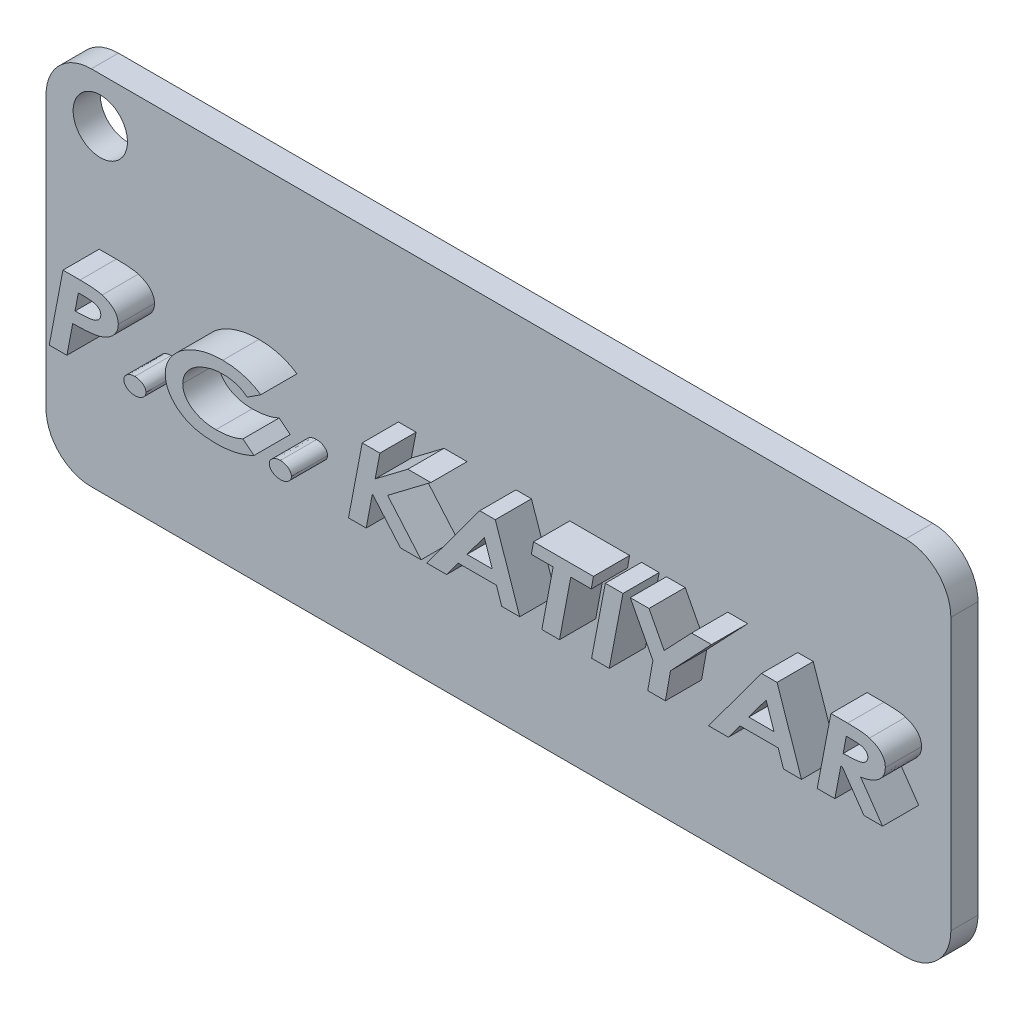
from build123d import *

# Parameters (mm, degrees)
BOSS_EXTRUDE1_DEPTH = 7
CUT_EXTRUDE2_DEPTH  = 2
BOSS_EXTRUDE2_DEPTH = 2
SKETCH14_W          = 50
SKETCH14_H          = 20
CUT_EXTRUDE8_DEPTH  = 2
SKETCH15_W          = 50
SKETCH15_H          = 20
CUT_EXTRUDE9_DEPTH  = 3.5
SKETCH16_R          = 1.5
CUT_EXTRUDE10_DEPTH = 3.5


with BuildPart() as part:
    # Sketch2 → Boss-Extrude1 (new body)
    with BuildSketch(Plane.XY):
        with BuildLine():
            Line((-22.5, -10), (22.5, -10))
            ThreePointArc((22.5, -10), (24.267766953, -9.267766953), (25, -7.5))
            Line((25, -7.5), (25, 7.5))
            ThreePointArc((25, 7.5), (24.267766953, 9.267766953), (22.5, 10))
            Line((22.5, 10), (-22.5, 10))
            ThreePointArc((-22.5, 10), (-24.267766953, 9.267766953), (-25, 7.5))
            Line((-25, 7.5), (-25, -7.5))
            ThreePointArc((-25, -7.5), (-24.267766953, -9.267766953), (-22.5, -10))
        make_face()
    extrude(amount=-BOSS_EXTRUDE1_DEPTH)

    # Sketch3 → Cut-Extrude2 (cut)
    with BuildSketch(Plane(origin=(0, 0, -7), x_dir=(-1, 0, 0), z_dir=(0, 0, -1))):
        with BuildLine():
            Line((-20.5, -8), (20.5, -8))
            ThreePointArc((20.5, -8), (22.267766953, -7.267766953), (23, -5.5))
            Line((23, -5.5), (23, 5.5))
            ThreePointArc((23, 5.5), (22.267766953, 7.267766953), (20.5, 8))
            Line((20.5, 8), (-20.5, 8))
            ThreePointArc((-20.5, 8), (-22.267766953, 7.267766953), (-23, 5.5))
            Line((-23, 5.5), (-23, -5.5))
            ThreePointArc((-23, -5.5), (-22.267766953, -7.267766953), (-20.5, -8))
        make_face()
    extrude(amount=-CUT_EXTRUDE2_DEPTH, mode=Mode.SUBTRACT)

    # Sketch5 → Boss-Extrude2 (add)
    # profile 1 of 11: a face of its own
    with BuildSketch(Plane.XY):
        with BuildLine():
            Line((-22.062655487, 1.585119323), (-21.115784243, 1.585119323))
            add(Edge.make_bspline(
                [(-21.115784243, 1.585119323), (-21.046347286, 1.584923025), (-20.913013856, 1.584546091), (-20.720854318, 1.578680325), (-20.544824071, 1.570314274), (-20.38445275, 1.558333743), (-20.240057002, 1.544038226), (-20.111537314, 1.524529867), (-19.998564044, 1.503771053), (-19.929755147, 1.483856589), (-19.897810485, 1.47461126)],
                knots=[0, 0, 0, 0, 1.358553691, 2.608706277, 3.761225862, 4.806342819, 5.755171958, 6.599208433, 7.349679831, 8, 8, 8, 8], degree=3))
            add(Edge.make_bspline(
                [(-19.897810485, 1.47461126), (-19.862142173, 1.463127485), (-19.792502501, 1.440706284), (-19.692986342, 1.400409035), (-19.599730839, 1.357669122), (-19.51289697, 1.311520104), (-19.432481143, 1.262460691), (-19.358744416, 1.209736648), (-19.291936002, 1.153440385), (-19.232010667, 1.093438482), (-19.178679589, 1.03079519), (-19.132301463, 0.965389138), (-19.09311573, 0.897540141), (-19.060987765, 0.827054161), (-19.03614147, 0.753527366), (-19.019260756, 0.677245067), (-19.00707271, 0.598619745), (-19.00622574, 0.545279075), (-19.005795761, 0.518199752)],
                knots=[0, 0, 0, 0, 1.276660213, 2.492582227, 3.656403132, 4.771545786, 5.841900154, 6.864511781, 7.857869233, 8.815819527, 9.751368605, 10.658498021, 11.544612112, 12.417650074, 13.294463908, 14.183977485, 15.078064426, 16, 16, 16, 16], degree=3))
            add(Edge.make_bspline(
                [(-19.005795761, 0.518199752), (-19.006510333, 0.488477554), (-19.007933397, 0.429286078), (-19.020875513, 0.341828806), (-19.042886627, 0.256846348), (-19.071982447, 0.173362418), (-19.111678127, 0.092832676), (-19.157520739, 0.013069541), (-19.213833084, -0.062914016), (-19.277366682, -0.136754965), (-19.347624943, -0.207107626), (-19.424478433, -0.272735555), (-19.50723746, -0.332739754), (-19.595123082, -0.388972412), (-19.689269565, -0.439769352), (-19.789110837, -0.485723286), (-19.894880016, -0.526317435), (-20.007996891, -0.562964252), (-20.134211975, -0.594162615), (-20.276983298, -0.621593658), (-20.438822371, -0.645146923), (-20.619424629, -0.664714114), (-20.818804268, -0.680404776), (-21.037255177, -0.691874785), (-21.274458726, -0.700899436), (-21.439084643, -0.703299804), (-21.524425569, -0.704544138)],
                knots=[0, 0, 0, 0, 0.688242521, 1.370628487, 2.042130763, 2.719778362, 3.414452177, 4.118823342, 4.848191774, 5.60127844, 6.373952161, 7.14901211, 7.939764489, 8.740180187, 9.564258587, 10.41577627, 11.284491428, 12.187244958, 13.168433779, 14.294132788, 15.553866063, 16.955823887, 18.50157366, 20.186153151, 22.022928429, 24, 24, 24, 24], degree=3))
            Line((-21.524425569, -0.704544138), (-21.845614471, -2.383630677))
            Line((-21.845614471, -2.383630677), (-22.82190153, -2.383630677))
            Line((-22.82190153, -2.383630677), (-22.062655487, 1.585119323))
        make_face()
        with BuildLine():
            add(Edge.make_bspline(
                [(-21.397222043, -0.043085805), (-21.326727305, -0.042246975), (-21.192070476, -0.040644669), (-20.999570874, -0.03489139), (-20.826187735, -0.023736079), (-20.672051894, -0.009138756), (-20.53725684, 0.009739171), (-20.421429542, 0.031877147), (-20.324944781, 0.059524974), (-20.245021746, 0.09039094), (-20.180356017, 0.127620223), (-20.124254392, 0.166231611), (-20.077888535, 0.210638747), (-20.039015151, 0.258397998), (-20.009391185, 0.310954803), (-19.987468978, 0.367318978), (-19.974597194, 0.428047077), (-19.973234602, 0.469908197), (-19.972542556, 0.491169003)],
                knots=[0, 0, 0, 0, 2.015913331, 3.850734162, 5.506089905, 6.983209899, 8.27670128, 9.39723723, 10.351734844, 11.143964697, 11.839511049, 12.480806679, 13.086506669, 13.668763104, 14.23552723, 14.804061629, 15.392595943, 16, 16, 16, 16], degree=3))
            add(Edge.make_bspline(
                [(-19.972542556, 0.491169003), (-19.973681404, 0.514886484), (-19.975925001, 0.561611322), (-19.996199624, 0.628643317), (-20.031130456, 0.688873984), (-20.077580592, 0.743542921), (-20.137934262, 0.790963965), (-20.210935481, 0.830320969), (-20.296542372, 0.862201442), (-20.377670416, 0.881323963), (-20.453559106, 0.893861983), (-20.524474113, 0.901195238), (-20.607931102, 0.908599402), (-20.704201452, 0.913641751), (-20.813106011, 0.918656069), (-20.934769153, 0.921658436), (-21.069139557, 0.923034578), (-21.162955237, 0.923445991), (-21.211981909, 0.92366099)],
                knots=[0, 0, 0, 0, 0.784190741, 1.544902002, 2.291614694, 3.075952733, 3.906502264, 4.817702394, 5.811960417, 6.923020294, 7.572247894, 8.358204391, 9.283036894, 10.346678085, 11.550108322, 12.893256878, 14.376462505, 16, 16, 16, 16], degree=3))
            Line((-21.211981909, 0.92366099), (-21.397222043, -0.043085805))
        make_face(mode=Mode.SUBTRACT)
    # profile 2 of 11: a face of its own
    with BuildSketch(Plane.XY):
        with BuildLine():
            add(Edge.make_bspline(
                [(-18.089930376, -1.518646702), (-18.049495524, -1.519929968), (-17.970681154, -1.522431269), (-17.857520098, -1.54898048), (-17.752678075, -1.590442412), (-17.674214536, -1.639675786), (-17.617955838, -1.685119371), (-17.580811101, -1.720991227), (-17.549794608, -1.759290621), (-17.524033872, -1.799222904), (-17.504043319, -1.840886466), (-17.489213264, -1.884290377), (-17.481585498, -1.929938038), (-17.480102811, -1.96092063), (-17.479353453, -1.976579395)],
                knots=[0, 0, 0, 0, 1.721928974, 3.356330997, 4.928568575, 6.512627655, 7.284123422, 8.011545403, 8.71066186, 9.38170703, 10.03392191, 10.677359324, 11.331530462, 12, 12, 12, 12], degree=3))
            add(Edge.make_bspline(
                [(-17.479353453, -1.976579395), (-17.480096192, -1.991975439), (-17.481565676, -2.022435994), (-17.489332125, -2.067520667), (-17.504034515, -2.110683155), (-17.524034431, -2.152347957), (-17.549801839, -2.192268285), (-17.58077969, -2.230617025), (-17.618203807, -2.266407811), (-17.673752259, -2.313010623), (-17.752989631, -2.361503193), (-17.857173734, -2.404736837), (-17.970867411, -2.4293882), (-18.049533204, -2.432773591), (-18.089930376, -2.434512087)],
                knots=[0, 0, 0, 0, 0.657885995, 1.301605321, 1.945722372, 2.598626161, 3.27038013, 3.970235035, 4.698425363, 5.477915097, 7.063647356, 8.641811216, 10.275472388, 12, 12, 12, 12], degree=3))
            add(Edge.make_bspline(
                [(-18.089930376, -2.434512087), (-18.130864166, -2.432797355), (-18.21033288, -2.429468381), (-18.324986133, -2.404650825), (-18.429838816, -2.362000598), (-18.522713501, -2.303666895), (-18.600950066, -2.234231435), (-18.658270232, -2.154881959), (-18.694294772, -2.06797376), (-18.698431403, -2.007118534), (-18.700507299, -1.976579395)],
                knots=[0, 0, 0, 0, 1.164019638, 2.259823604, 3.318264968, 4.36837637, 5.366452163, 6.2744366, 7.134055954, 8, 8, 8, 8], degree=3))
            add(Edge.make_bspline(
                [(-18.700507299, -1.976579395), (-18.69975227, -1.960923396), (-18.698258362, -1.929946276), (-18.690712929, -1.884258466), (-18.675612372, -1.841111577), (-18.656854306, -1.798974208), (-18.630710394, -1.759602571), (-18.600753545, -1.720686323), (-18.56349347, -1.685414571), (-18.50829092, -1.63942498), (-18.429968159, -1.590117168), (-18.324691182, -1.549021189), (-18.210504965, -1.52236192), (-18.130897346, -1.519909002), (-18.089930376, -1.518646702)],
                knots=[0, 0, 0, 0, 0.667698794, 1.321115674, 1.963811206, 2.610461825, 3.280733282, 3.971979179, 4.698562444, 5.460433722, 7.033089376, 8.613992008, 10.25752247, 12, 12, 12, 12], degree=3))
        make_face()
    # profile 3 of 11: a face of its own
    with BuildSketch(Plane.XY):
        with BuildLine():
            Line((-11.132692546, 1.085845485), (-11.881603303, 0.593726845))
            add(Edge.make_bspline(
                [(-11.881603303, 0.593726845), (-11.923562265, 0.627314114), (-12.008638639, 0.695415968), (-12.151765717, 0.780674808), (-12.307463858, 0.854901668), (-12.475847445, 0.916255533), (-12.654190151, 0.965495989), (-12.841148347, 1.000313767), (-13.035495412, 1.021252539), (-13.167631772, 1.024018998), (-13.234730807, 1.02542381)],
                knots=[0, 0, 0, 0, 0.889229551, 1.803009952, 2.751198743, 3.742627655, 4.766939058, 5.811943641, 6.888901805, 8, 8, 8, 8], degree=3))
            add(Edge.make_bspline(
                [(-13.234730807, 1.02542381), (-13.282184801, 1.024862225), (-13.376941556, 1.023740843), (-13.51812958, 1.01316255), (-13.657890686, 0.995454725), (-13.796090126, 0.971562928), (-13.933261695, 0.941809562), (-14.068325215, 0.903103243), (-14.202036525, 0.858602603), (-14.333559695, 0.80812665), (-14.460328424, 0.751411346), (-14.580864544, 0.689770032), (-14.69473935, 0.625147461), (-14.800882854, 0.554881541), (-14.899411749, 0.479978456), (-14.991460245, 0.401568616), (-15.074814192, 0.317308467), (-15.152137059, 0.230638368), (-15.22021116, 0.13990146), (-15.280087387, 0.047914827), (-15.330693605, -0.045914637), (-15.372101932, -0.141075571), (-15.404188062, -0.238235203), (-15.427283192, -0.336631816), (-15.44117275, -0.436756529), (-15.44311974, -0.503890968), (-15.444097043, -0.537589511)],
                knots=[0, 0, 0, 0, 1.147840019, 2.292021974, 3.422762477, 4.554719973, 5.683987435, 6.816453138, 7.951746113, 9.092312325, 10.222980131, 11.309625257, 12.366415312, 13.388810317, 14.386361657, 15.359174227, 16.311146327, 17.251367513, 18.166849566, 19.052414659, 19.904318703, 20.742752482, 21.559760478, 22.376164587, 23.184905847, 24, 24, 24, 24], degree=3))
            add(Edge.make_bspline(
                [(-15.444097043, -0.537589511), (-15.442603717, -0.582745314), (-15.439657018, -0.671848801), (-15.415159431, -0.802654497), (-15.374445467, -0.92743692), (-15.317252331, -1.046242096), (-15.244137437, -1.159025047), (-15.155290415, -1.266015891), (-15.049924195, -1.366676674), (-14.929655641, -1.46041849), (-14.796735847, -1.545585606), (-14.654044304, -1.620690858), (-14.50174056, -1.683677816), (-14.340568182, -1.735112577), (-14.17010218, -1.774841065), (-13.99101806, -1.803018314), (-13.802750069, -1.821160245), (-13.674156086, -1.822996219), (-13.608391164, -1.823935164)],
                knots=[0, 0, 0, 0, 0.869533254, 1.715802623, 2.553836954, 3.391995718, 4.248873622, 5.13734536, 6.065429815, 7.051113934, 8.070898248, 9.103247636, 10.153921072, 11.242293882, 12.359451302, 13.522930763, 14.733189048, 16, 16, 16, 16], degree=3))
            add(Edge.make_bspline(
                [(-13.608391164, -1.823935164), (-13.537874759, -1.823041656), (-13.398813925, -1.821279626), (-13.193967102, -1.806683414), (-12.99625329, -1.783036157), (-12.805934515, -1.749700301), (-12.622715292, -1.70688744), (-12.446734812, -1.654265982), (-12.277511195, -1.59285337), (-12.169618838, -1.543240585), (-12.116134803, -1.518646702)],
                knots=[0, 0, 0, 0, 1.101721473, 2.17263358, 3.207027447, 4.211833084, 5.190103856, 6.145147665, 7.080518871, 8, 8, 8, 8], degree=3))
            Line((-12.116134803, -1.518646702), (-11.507942947, -2.00997032))
            add(Edge.make_bspline(
                [(-11.507942947, -2.00997032), (-11.585643588, -2.048117935), (-11.741953384, -2.124859204), (-11.986691837, -2.221542025), (-12.240639696, -2.302149423), (-12.50338268, -2.369322998), (-12.774972087, -2.421597605), (-13.05581041, -2.458767878), (-13.345650964, -2.48160382), (-13.542097027, -2.484117798), (-13.641782089, -2.485393497)],
                knots=[0, 0, 0, 0, 0.941032961, 1.893068937, 2.858239335, 3.836792255, 4.840579133, 5.864002295, 6.916104196, 8, 8, 8, 8], degree=3))
            add(Edge.make_bspline(
                [(-13.641782089, -2.485393497), (-13.711495099, -2.484607427), (-13.848360896, -2.483064154), (-14.049640733, -2.471613631), (-14.243078923, -2.4538493), (-14.428463908, -2.42743739), (-14.605732473, -2.394297548), (-14.775151289, -2.353840473), (-14.936460584, -2.305313237), (-15.090239665, -2.249794382), (-15.236195439, -2.18674311), (-15.37475694, -2.117048746), (-15.50533496, -2.039473514), (-15.629128301, -1.956028914), (-15.745465561, -1.865159349), (-15.854645022, -1.767153719), (-15.956463404, -1.662277524), (-16.04991557, -1.551005457), (-16.135202308, -1.435885448), (-16.208071857, -1.316299422), (-16.270685561, -1.195044811), (-16.321977421, -1.071178427), (-16.36157444, -0.944744182), (-16.39067839, -0.815873637), (-16.407577829, -0.684593125), (-16.409753394, -0.596203044), (-16.410843838, -0.551899908)],
                knots=[0, 0, 0, 0, 1.335518246, 2.621989339, 3.86123831, 5.056008121, 6.208106868, 7.315158899, 8.391336172, 9.433675789, 10.445662686, 11.435631841, 12.40301568, 13.353532088, 14.293988395, 15.22875383, 16.162277527, 17.091871979, 18.010882944, 18.904279217, 19.771675937, 20.623070725, 21.469302921, 22.306901117, 23.151379999, 24, 24, 24, 24], degree=3))
            add(Edge.make_bspline(
                [(-16.410843838, -0.551899908), (-16.409778879, -0.504114587), (-16.407650667, -0.408620548), (-16.385419817, -0.266395292), (-16.352736297, -0.125403416), (-16.304696827, 0.013601469), (-16.245644649, 0.151710267), (-16.17035142, 0.286982347), (-16.083851498, 0.421828681), (-15.983565886, 0.553620313), (-15.87332213, 0.682348963), (-15.750753587, 0.802869297), (-15.620117753, 0.917819897), (-15.480254165, 1.026133422), (-15.330173894, 1.126343539), (-15.170633519, 1.21929374), (-15.001999086, 1.306139252), (-14.824283436, 1.38508489), (-14.64032478, 1.456499012), (-14.450882393, 1.517612576), (-14.257577322, 1.570305818), (-14.059915904, 1.613291689), (-13.858110412, 1.645488979), (-13.652584027, 1.669545234), (-13.442710117, 1.684168847), (-13.301270631, 1.685972693), (-13.229960675, 1.686882144)],
                knots=[0, 0, 0, 0, 0.802901381, 1.604515664, 2.41515796, 3.2338925, 4.074136508, 4.937632603, 5.833775986, 6.766009382, 7.720128157, 8.68118343, 9.653730431, 10.644883943, 11.653395727, 12.685928506, 13.748188712, 14.841321317, 15.954372672, 17.064825198, 18.18690293, 19.322280764, 20.464398356, 21.621835016, 22.800993672, 24, 24, 24, 24], degree=3))
            add(Edge.make_bspline(
                [(-13.229960675, 1.686882144), (-13.130517764, 1.685037945), (-12.934680997, 1.681406095), (-12.646152122, 1.653045864), (-12.367888771, 1.60652707), (-12.100089605, 1.540277527), (-11.842106715, 1.455984187), (-11.594529515, 1.352511007), (-11.356877226, 1.23011651), (-11.207490537, 1.133980723), (-11.132692546, 1.085845485)],
                knots=[0, 0, 0, 0, 1.077363834, 2.121694222, 3.138067454, 4.131892869, 5.108055193, 6.07597234, 7.036638365, 8, 8, 8, 8], degree=3))
        make_face()
    # profile 4 of 11: a face of its own
    with BuildSketch(Plane.XY):
        with BuildLine():
            add(Edge.make_bspline(
                [(-10.050667556, -1.518646702), (-10.010232704, -1.519929968), (-9.931418333, -1.522431269), (-9.818257278, -1.54898048), (-9.713415255, -1.590442412), (-9.634951716, -1.639675786), (-9.578693017, -1.685119371), (-9.54154828, -1.720991227), (-9.510531788, -1.759290621), (-9.484771051, -1.799222904), (-9.464780498, -1.840886466), (-9.449950443, -1.884290377), (-9.442322677, -1.929938038), (-9.440839991, -1.96092063), (-9.440090633, -1.976579395)],
                knots=[0, 0, 0, 0, 1.721928974, 3.356330997, 4.928568575, 6.512627655, 7.284123422, 8.011545403, 8.71066186, 9.38170703, 10.03392191, 10.677359324, 11.331530462, 12, 12, 12, 12], degree=3))
            add(Edge.make_bspline(
                [(-9.440090633, -1.976579395), (-9.440833372, -1.991975439), (-9.442302855, -2.022435994), (-9.450069305, -2.067520667), (-9.464771694, -2.110683155), (-9.484771611, -2.152347957), (-9.510539019, -2.192268285), (-9.541516869, -2.230617025), (-9.578940986, -2.266407811), (-9.634489439, -2.313010623), (-9.71372681, -2.361503193), (-9.817910913, -2.404736837), (-9.931604591, -2.4293882), (-10.010270383, -2.432773591), (-10.050667556, -2.434512087)],
                knots=[0, 0, 0, 0, 0.657885995, 1.301605321, 1.945722372, 2.598626161, 3.27038013, 3.970235035, 4.698425363, 5.477915097, 7.063647356, 8.641811216, 10.275472388, 12, 12, 12, 12], degree=3))
            add(Edge.make_bspline(
                [(-10.050667556, -2.434512087), (-10.091601345, -2.432797355), (-10.17107006, -2.429468381), (-10.285723313, -2.404650825), (-10.390575996, -2.362000598), (-10.483450681, -2.303666895), (-10.561687246, -2.234231435), (-10.619007412, -2.154881959), (-10.655031952, -2.06797376), (-10.659168583, -2.007118534), (-10.661244479, -1.976579395)],
                knots=[0, 0, 0, 0, 1.164019638, 2.259823604, 3.318264968, 4.36837637, 5.366452163, 6.2744366, 7.134055954, 8, 8, 8, 8], degree=3))
            add(Edge.make_bspline(
                [(-10.661244479, -1.976579395), (-10.66048945, -1.960923396), (-10.658995541, -1.929946276), (-10.651450108, -1.884258466), (-10.636349552, -1.841111577), (-10.617591485, -1.798974208), (-10.591447574, -1.759602571), (-10.561490725, -1.720686323), (-10.524230649, -1.685414571), (-10.469028099, -1.63942498), (-10.390705339, -1.590117168), (-10.285428362, -1.549021189), (-10.171242145, -1.52236192), (-10.091634526, -1.519909002), (-10.050667556, -1.518646702)],
                knots=[0, 0, 0, 0, 0.667698794, 1.321115674, 1.963811206, 2.610461825, 3.280733282, 3.971979179, 4.698562444, 5.460433722, 7.033089376, 8.613992008, 10.25752247, 12, 12, 12, 12], degree=3))
        make_face()
    # profile 5 of 11: a face of its own
    with BuildSketch(Plane.XY):
        Polygon((-5.526197153, 1.585119323), (-4.549910094, 1.585119323), (-4.810677322, 0.218476445), (-3.005182279, 1.585119323), (-1.731556979, 1.585119323), (-4.123778283, -0.224350829), (-2.272966985, -2.383630677), (-3.414618628, -2.383630677), (-4.963321552, -0.575750569), (-5.309156138, -2.383630677), (-6.285443197, -2.383630677), align=None)
    # profile 6 of 11: a face of its own
    with BuildSketch(Plane.XY):
        Polygon((0.969132875, 1.585119323), (1.826166629, 1.585119323), (3.178499111, -2.383630677), (2.181541479, -2.383630677), (1.887383326, -1.518646702), (-0.224990222, -1.518646702), (-0.863392916, -2.383630677), (-1.960523325, -2.383630677), align=None)
        Polygon((1.661597068, -0.857188369), (1.220359838, 0.43949257), (0.263153307, -0.857188369), align=None, mode=Mode.SUBTRACT)
    # profile 7 of 11: a face of its own
    with BuildSketch(Plane.XY):
        Polygon((3.941720265, 1.585119323), (7.249011931, 1.585119323), (7.13134867, 0.92366099), (5.99844227, 0.92366099), (5.375144994, -2.383630677), (4.399652957, -2.383630677), (5.022950233, 0.92366099), (3.816901805, 0.92366099), align=None)
    # profile 8 of 11: a face of its own
    with BuildSketch(Plane.XY):
        Polygon((7.906495154, 1.585119323), (8.882782214, 1.585119323), (8.12353617, -2.383630677), (7.147249111, -2.383630677), align=None)
    # profile 9 of 11: a face of its own
    with BuildSketch(Plane.XY):
        Polygon((9.284268342, 1.585119323), (10.319387031, 1.585119323), (11.158135279, -0.012079946), (12.6742423, 1.585119323), (13.774552797, 1.585119323), (11.508739996, -0.801536827), (11.225712152, -2.383630677), (10.251015136, -2.383630677), (10.534838003, -0.797561716), align=None)
    # profile 10 of 11: a face of its own
    with BuildSketch(Plane.XY):
        Polygon((16.538844413, 1.585119323), (17.395878167, 1.585119323), (18.748210649, -2.383630677), (17.751253017, -2.383630677), (17.457094864, -1.518646702), (15.344721316, -1.518646702), (14.706318622, -2.383630677), (13.609188213, -2.383630677), align=None)
        Polygon((17.231308606, -0.857188369), (16.790071376, 0.43949257), (15.832864846, -0.857188369), align=None, mode=Mode.SUBTRACT)
    # profile 11 of 11: a face of its own
    with BuildSketch(Plane.XY):
        with BuildLine():
            Line((20.372440667, 1.585119323), (21.296256272, 1.585119323))
            add(Edge.make_bspline(
                [(21.296256272, 1.585119323), (21.364897656, 1.584912264), (21.497170108, 1.584513258), (21.687482531, 1.5787606), (21.861903515, 1.570177483), (22.020504785, 1.558694865), (22.163168872, 1.54290706), (22.290297173, 1.524109823), (22.401477252, 1.501994215), (22.469288073, 1.482196409), (22.500714656, 1.473021216)],
                knots=[0, 0, 0, 0, 1.357552076, 2.616012828, 3.765317172, 4.811306205, 5.760556428, 6.603372588, 7.352740091, 8, 8, 8, 8], degree=3))
            add(Edge.make_bspline(
                [(22.500714656, 1.473021216), (22.536088956, 1.46119059), (22.60507071, 1.438120244), (22.704173212, 1.398234342), (22.796402983, 1.354404852), (22.882367206, 1.307781822), (22.96131326, 1.257650455), (23.033537671, 1.204201062), (23.09867077, 1.146764428), (23.157928225, 1.086571186), (23.209374738, 1.022480307), (23.255608963, 0.956758844), (23.2925185, 0.886507447), (23.325007119, 0.814715213), (23.348541815, 0.739014718), (23.366179286, 0.661176861), (23.376834207, 0.580241953), (23.377885233, 0.525386693), (23.378418983, 0.497529179)],
                knots=[0, 0, 0, 0, 1.265921014, 2.468612838, 3.62342398, 4.730439793, 5.786007646, 6.795294932, 7.776904084, 8.731092297, 9.658314142, 10.564037002, 11.453533417, 12.347702471, 13.235286478, 14.138773092, 15.054800702, 16, 16, 16, 16], degree=3))
            add(Edge.make_bspline(
                [(23.378418983, 0.497529179), (23.377311606, 0.463282067), (23.37511914, 0.395477054), (23.358789285, 0.295749378), (23.332379099, 0.199556011), (23.295819506, 0.106788722), (23.247709076, 0.017953725), (23.188294069, -0.066219058), (23.119336224, -0.147362024), (23.039671869, -0.224186334), (22.949755587, -0.29712389), (22.847763038, -0.362525214), (22.736393284, -0.424356388), (22.613400043, -0.478604004), (22.480132268, -0.527991582), (22.336016921, -0.571695528), (22.180798341, -0.608654028), (22.073348184, -0.628932497), (22.01813628, -0.639352331)],
                knots=[0, 0, 0, 0, 0.84795453, 1.678844306, 2.495720211, 3.314781864, 4.142971073, 4.991484286, 5.8621746, 6.776595148, 7.728887828, 8.724701739, 9.773425959, 10.881047807, 12.05027784, 13.291932935, 14.608493983, 16, 16, 16, 16], degree=3))
            Line((22.01813628, -0.639352331), (23.224184708, -2.383630677))
            Line((23.224184708, -2.383630677), (22.198606282, -2.383630677))
            Line((22.198606282, -2.383630677), (21.002893141, -0.653662728))
            Line((21.002893141, -0.653662728), (20.92021085, -0.653662728))
            Line((20.92021085, -0.653662728), (20.589481683, -2.383630677))
            Line((20.589481683, -2.383630677), (19.613194624, -2.383630677))
            Line((19.613194624, -2.383630677), (20.372440667, 1.585119323))
        make_face()
        with BuildLine():
            add(Edge.make_bspline(
                [(21.047414375, 0.007795605), (21.115262158, 0.008264189), (21.244629315, 0.009157651), (21.429399073, 0.015522081), (21.595668758, 0.025433228), (21.743598129, 0.039788122), (21.873212535, 0.056500078), (21.984265173, 0.077716474), (22.076948797, 0.102136526), (22.152580898, 0.132209502), (22.214557467, 0.166296261), (22.266939657, 0.204191846), (22.31177208, 0.245170978), (22.348392195, 0.290791511), (22.377244217, 0.339943587), (22.397373996, 0.393726643), (22.409473769, 0.451139692), (22.410930887, 0.490844789), (22.411672188, 0.511044554)],
                knots=[0, 0, 0, 0, 2.030592, 3.871783324, 5.532661145, 7.014803794, 8.319353416, 9.442431818, 10.396846624, 11.183341516, 11.872054959, 12.508254593, 13.114375564, 13.684172116, 14.252808241, 14.812580223, 15.395906282, 16, 16, 16, 16], degree=3))
            add(Edge.make_bspline(
                [(22.411672188, 0.511044554), (22.41051341, 0.533973376), (22.408246918, 0.578820605), (22.388425204, 0.643299391), (22.355148965, 0.701501762), (22.308667087, 0.752925904), (22.25064152, 0.797490572), (22.181271744, 0.835323735), (22.099949182, 0.863661924), (22.02389533, 0.883476855), (21.952296099, 0.894313764), (21.884950234, 0.902206546), (21.805161571, 0.909268863), (21.712635533, 0.914723712), (21.607920147, 0.918308484), (21.490527247, 0.921780718), (21.360655127, 0.9229986), (21.269755372, 0.923433853), (21.222319223, 0.92366099)],
                knots=[0, 0, 0, 0, 0.790983171, 1.547109702, 2.305893591, 3.090756363, 3.926089083, 4.823614, 5.80867814, 6.894811459, 7.534688779, 8.30938778, 9.23800478, 10.302258371, 11.511973469, 12.85868906, 14.360703023, 16, 16, 16, 16], degree=3))
            Line((21.222319223, 0.92366099), (21.047414375, 0.007795605))
        make_face(mode=Mode.SUBTRACT)
    extrude(amount=BOSS_EXTRUDE2_DEPTH)

    # Sketch14 → Cut-Extrude8 (cut)
    with BuildSketch(Plane(origin=(0, 0, -5), x_dir=(-1, 0, 0), z_dir=(0, 0, -1))):
        Rectangle(SKETCH14_W, SKETCH14_H)
    extrude(amount=CUT_EXTRUDE8_DEPTH, mode=Mode.SUBTRACT)

    # Sketch15 → Cut-Extrude9 (cut)
    with BuildSketch(Plane(origin=(0, 0, -5), x_dir=(-1, 0, 0), z_dir=(0, 0, -1))):
        Rectangle(SKETCH15_W, SKETCH15_H)
    extrude(amount=-CUT_EXTRUDE9_DEPTH, mode=Mode.SUBTRACT)

    # Sketch16 → Cut-Extrude10 (cut)
    with BuildSketch(Plane.XY):
        with Locations((-22, 7.5)):
            Circle(SKETCH16_R)
    extrude(amount=-CUT_EXTRUDE10_DEPTH, mode=Mode.SUBTRACT)


solid = part.part
